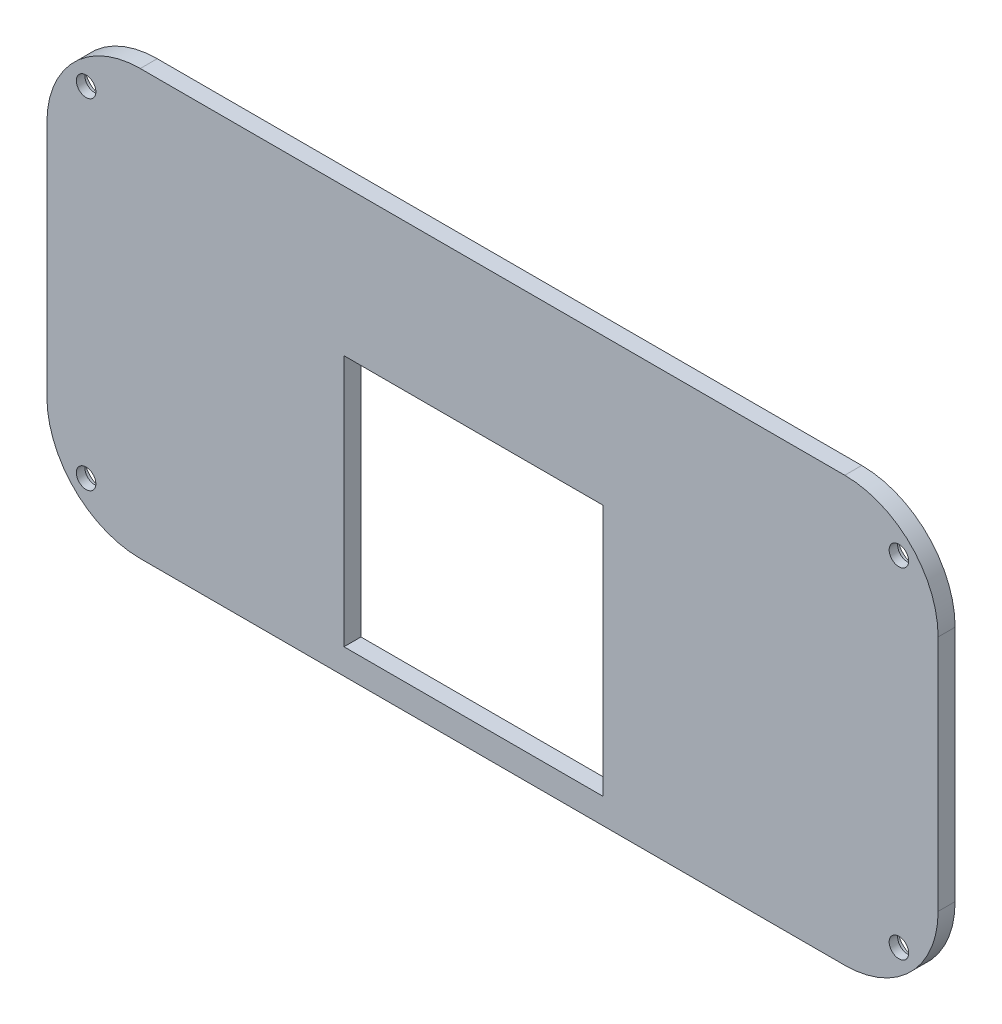
from build123d import *

# Parameters (mm, degrees)
SKETCH_1_W          = 105
SKETCH_1_H          = 50
EXTRUDE_1_DEPTH     = 2
FILLET_1_R          = 11
SKETCH_3_R          = 2.15
CUT_EXTRUDE_1_DEPTH = 1
CUT_EXTRUDE_2_REACH = 60.157
SKETCH_4_R          = 1.15
CUT_EXTRUDE_3_REACH = 60.183
SKETCH_5_W          = 30.5
SKETCH_5_H          = 29.7


with BuildPart() as part:
    # 草图1 → 凸台-拉伸1 (new body)
    with BuildSketch(Plane.XY):
        Rectangle(SKETCH_1_W, SKETCH_1_H)
    extrude(amount=EXTRUDE_1_DEPTH)

    # 圆角1
    fillet_1_edges = [part.edges().sort_by_distance(p)[0] for p in [
        (52.5, -25, 1),
        (-52.5, -25, 1),
        (-52.5, 25, 1),
        (52.5, 25, 1),
    ]]
    fillet(fillet_1_edges, radius=FILLET_1_R)

    # 草图3 → 切除-拉伸1 (cut)
    with BuildSketch(Plane(origin=(0, 0, 0), x_dir=(-1, 0, 0), z_dir=(0, 0, -1))):
        with Locations((47.88083152, -20)):
            Circle(SKETCH_3_R)
        with Locations((47.88083152, 20)):
            Circle(SKETCH_3_R)
        with Locations((-47.88083152, 20)):
            Circle(SKETCH_3_R)
        with Locations((-47.88083152, -20)):
            Circle(SKETCH_3_R)
    extrude(amount=-CUT_EXTRUDE_1_DEPTH, mode=Mode.SUBTRACT)

    # 草图4 → 切除-拉伸2 (cut, up to next)
    with BuildSketch(Plane(origin=(0, 0, 1), x_dir=(-1, 0, 0), z_dir=(0, 0, -1)), mode=Mode.PRIVATE) as cut_extrude_2_sk1:
        with Locations((47.88083152, -20)):
            Circle(SKETCH_4_R)
    cut_extrude_2_tool1 = extrude(cut_extrude_2_sk1.sketch, amount=-CUT_EXTRUDE_2_REACH, mode=Mode.PRIVATE) & part.part
    # 草图4 → 切除-拉伸2 (cut, up to next)
    with BuildSketch(Plane(origin=(0, 0, 1), x_dir=(-1, 0, 0), z_dir=(0, 0, -1)), mode=Mode.PRIVATE) as cut_extrude_2_sk2:
        with Locations((-47.88083152, -20)):
            Circle(SKETCH_4_R)
    cut_extrude_2_tool2 = extrude(cut_extrude_2_sk2.sketch, amount=-CUT_EXTRUDE_2_REACH, mode=Mode.PRIVATE) & part.part
    # 草图4 → 切除-拉伸2 (cut, up to next)
    with BuildSketch(Plane(origin=(0, 0, 1), x_dir=(-1, 0, 0), z_dir=(0, 0, -1)), mode=Mode.PRIVATE) as cut_extrude_2_sk3:
        with Locations((47.88083152, 20)):
            Circle(SKETCH_4_R)
    cut_extrude_2_tool3 = extrude(cut_extrude_2_sk3.sketch, amount=-CUT_EXTRUDE_2_REACH, mode=Mode.PRIVATE) & part.part
    # 草图4 → 切除-拉伸2 (cut, up to next)
    with BuildSketch(Plane(origin=(0, 0, 1), x_dir=(-1, 0, 0), z_dir=(0, 0, -1)), mode=Mode.PRIVATE) as cut_extrude_2_sk4:
        with Locations((-47.88083152, 20)):
            Circle(SKETCH_4_R)
    cut_extrude_2_tool4 = extrude(cut_extrude_2_sk4.sketch, amount=-CUT_EXTRUDE_2_REACH, mode=Mode.PRIVATE) & part.part
    add(cut_extrude_2_tool1.solids().sort_by_distance((-47.880832, -20, 1))[0], mode=Mode.SUBTRACT)
    add(cut_extrude_2_tool2.solids().sort_by_distance((47.880832, -20, 1))[0], mode=Mode.SUBTRACT)
    add(cut_extrude_2_tool3.solids().sort_by_distance((-47.880832, 20, 1))[0], mode=Mode.SUBTRACT)
    add(cut_extrude_2_tool4.solids().sort_by_distance((47.880832, 20, 1))[0], mode=Mode.SUBTRACT)

    # 草图5 → 切除-拉伸3 (cut, up to next)
    with BuildSketch(Plane(origin=(0, 0, 0), x_dir=(-1, 0, 0), z_dir=(0, 0, -1)), mode=Mode.PRIVATE) as cut_extrude_3_sk1:
        with Locations((2.25, -7.15)):
            Rectangle(SKETCH_5_W, SKETCH_5_H)
    cut_extrude_3_tool1 = extrude(cut_extrude_3_sk1.sketch, amount=-CUT_EXTRUDE_3_REACH, mode=Mode.PRIVATE) & part.part
    add(cut_extrude_3_tool1.solids().sort_by_distance((-2.25, -7.15, 0))[0], mode=Mode.SUBTRACT)


solid = part.part
